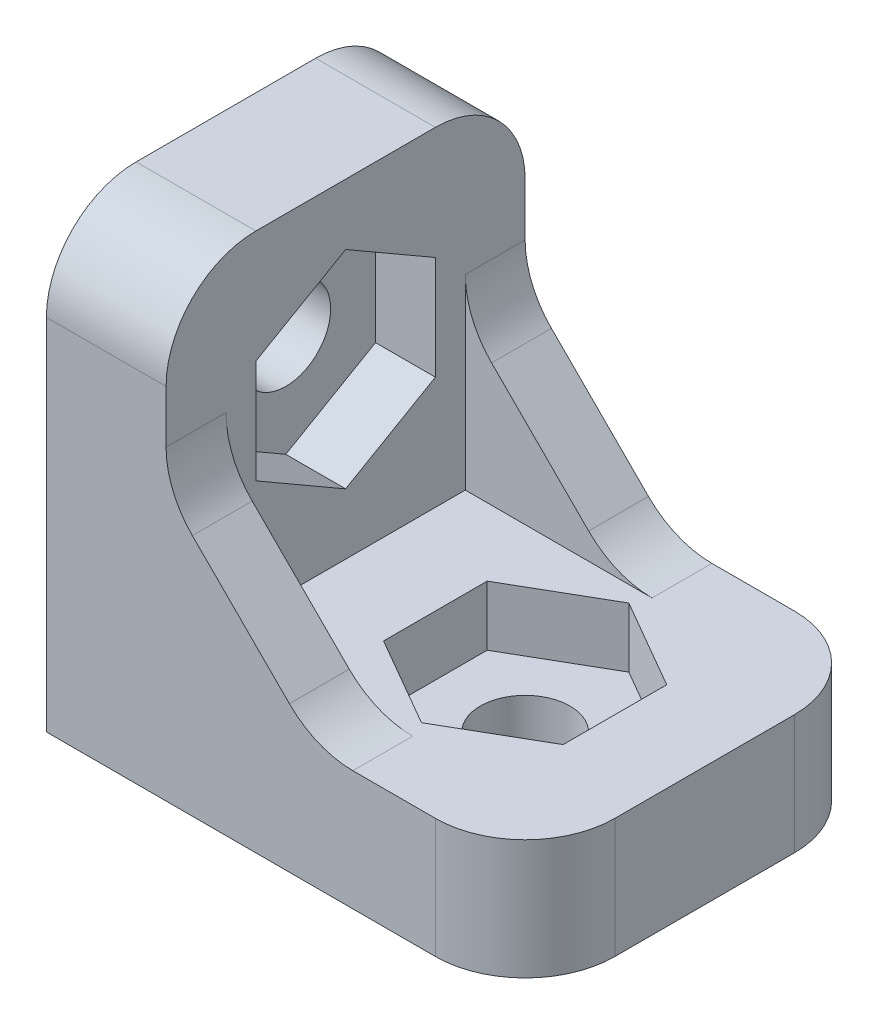
from build123d import *

# Parameters (mm, degrees)
BOSS_EXTRUDE1_DEPTH = 12
SKETCH2_R           = 1.5
CUT_EXTRUDE1_DEPTH  = 23.649503306
CUT_EXTRUDE2_DEPTH  = 2
SKETCH4_R           = 1.5
CUT_EXTRUDE3_DEPTH  = 26
CUT_EXTRUDE4_DEPTH  = 2
BOSS_EXTRUDE2_DEPTH = 2
BOSS_EXTRUDE3_DEPTH = 2
FILLET1_R           = 3


with BuildPart() as part:
    # Sketch1 → Boss-Extrude1 (new body)
    with BuildSketch(Plane.XY):
        Polygon((0, 0), (0, 15), (4, 15), (4, 4), (16, 4), (16, 0), align=None)
    extrude(amount=BOSS_EXTRUDE1_DEPTH)

    # Sketch2 → Cut-Extrude1 (cut, through all)
    with BuildSketch(Plane(origin=(4, 0, 0), x_dir=(0, 0, -1), z_dir=(1, 0, 0))):
        with Locations(Location((-6, 9.5, 0), (0, 0, 90))):
            Circle(SKETCH2_R)
    extrude(amount=-CUT_EXTRUDE1_DEPTH, mode=Mode.SUBTRACT)

    # Sketch3 → Cut-Extrude2 (cut)
    with BuildSketch(Plane(origin=(4, 0, 0), x_dir=(0, 0, -1), z_dir=(1, 0, 0))):
        Polygon((-6, 12.964101615), (-9, 11.232050808), (-9, 7.767949192), (-6, 6.035898385), (-3, 7.767949192), (-3, 11.232050808), align=None)
    extrude(amount=-CUT_EXTRUDE2_DEPTH, mode=Mode.SUBTRACT)

    # Sketch4 → Cut-Extrude3 (cut, through all)
    with BuildSketch(Plane.XZ):
        with Locations((10, 6)):
            Circle(SKETCH4_R)
    extrude(amount=-CUT_EXTRUDE3_DEPTH, mode=Mode.SUBTRACT)

    # Sketch5 → Cut-Extrude4 (cut)
    with BuildSketch(Plane(origin=(0, 4, 0), x_dir=(1, 0, 0), z_dir=(0, 1, 0))):
        Polygon((10, -9.464101615), (13, -7.732050808), (13, -4.267949192), (10, -2.535898385), (7, -4.267949192), (7, -7.732050808), align=None)
    extrude(amount=-CUT_EXTRUDE4_DEPTH, mode=Mode.SUBTRACT)

    # Sketch6 → Boss-Extrude2 (add)
    with BuildSketch(Plane(origin=(0, 0, 0), x_dir=(-1, 0, 0), z_dir=(0, 0, -1))):
        Polygon((-4, 4), (-4, 9), (-9, 4), align=None)
    extrude(amount=-BOSS_EXTRUDE2_DEPTH)

    # Sketch7 → Boss-Extrude3 (add)
    with BuildSketch(Plane.XY.offset(12)):
        Polygon((4, 9), (4, 4), (9, 4), align=None)
    extrude(amount=-BOSS_EXTRUDE3_DEPTH)

    # Fillet1
    fillet1_edges = [part.edges().sort_by_distance(p)[0] for p in [
        (2, 15, 12),
        (2, 15, 0),
        (16, 2, 12),
        (9, 4, 1),
        (4, 9, 1),
        (16, 2, 0),
        (9, 4, 11),
        (4, 9, 11),
    ]]
    fillet(fillet1_edges, radius=FILLET1_R)


solid = part.part
